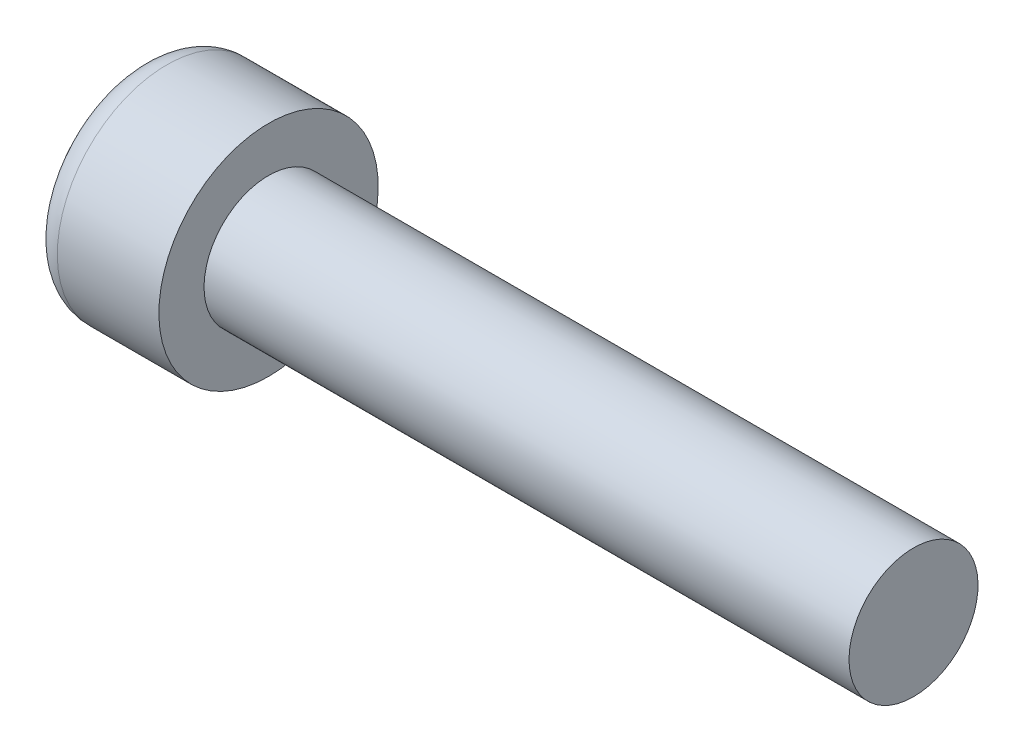
from build123d import *

# Parameters (mm, degrees)
CUT_EXTRUDE1_DEPTH = 2.5


with BuildPart() as part:
    # Sketch1 → Revolve1 (revolve)
    with BuildSketch(Plane.XY, mode=Mode.PRIVATE) as revolve1_sk:
        with BuildLine():
            Line((0, 0), (0, 3.1875))
            ThreePointArc((0, 3.1875), (0.311199045, 3.938800955), (1.0625, 4.25))
            Line((1.0625, 4.25), (5, 4.25))
            Line((5, 4.25), (5, 2.5))
            Line((5, 2.5), (30, 2.5))
            Line((30, 2.5), (30, 0))
            Line((30, 0), (0, 0))
        make_face()
    revolve(revolve1_sk.sketch.rotate(Axis((0, 0, 0), (1, 0, 0)), 180), axis=Axis((0, 0, 0), (1, 0, 0)))

    # Sketch2 → Cut-Extrude1 (cut)
    with BuildSketch(Plane.ZY):
        Polygon((0, 2.309401077), (-2, 1.154700538), (-2, -1.154700538), (0, -2.309401077), (2, -1.154700538), (2, 1.154700538), align=None)
    extrude(amount=-CUT_EXTRUDE1_DEPTH, mode=Mode.SUBTRACT)


solid = part.part
